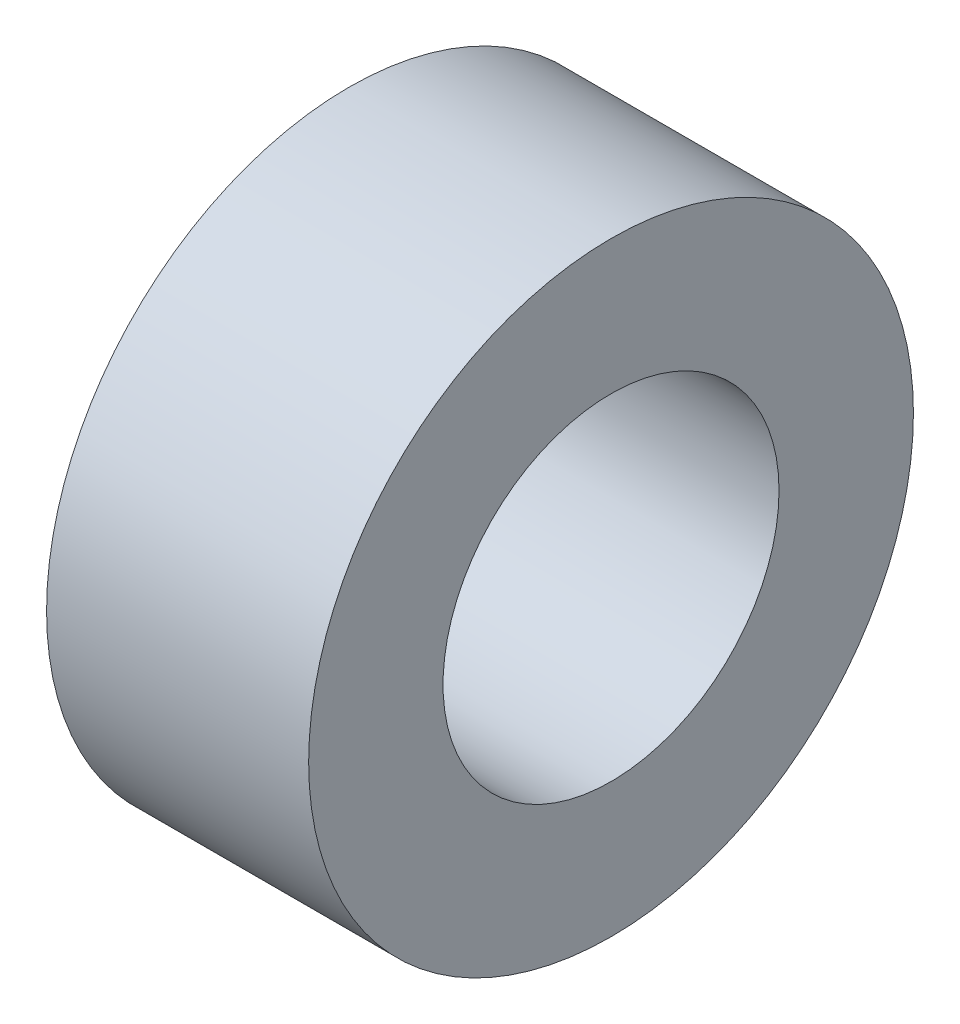
from build123d import *

# Parameters (mm, degrees)
SKETCH1_W = 39
SKETCH1_H = 20


with BuildPart() as part:
    # Sketch1 → Revolve1 (revolve)
    with BuildSketch(Plane.XY, mode=Mode.PRIVATE) as revolve1_sk:
        with Locations((0, 35)):
            Rectangle(SKETCH1_W, SKETCH1_H)
    revolve(revolve1_sk.sketch.rotate(Axis((54.903846154, 0, 0), (-1, 0, 0)), 90), axis=Axis((54.903846154, 0, 0), (-1, 0, 0)))


solid = part.part
